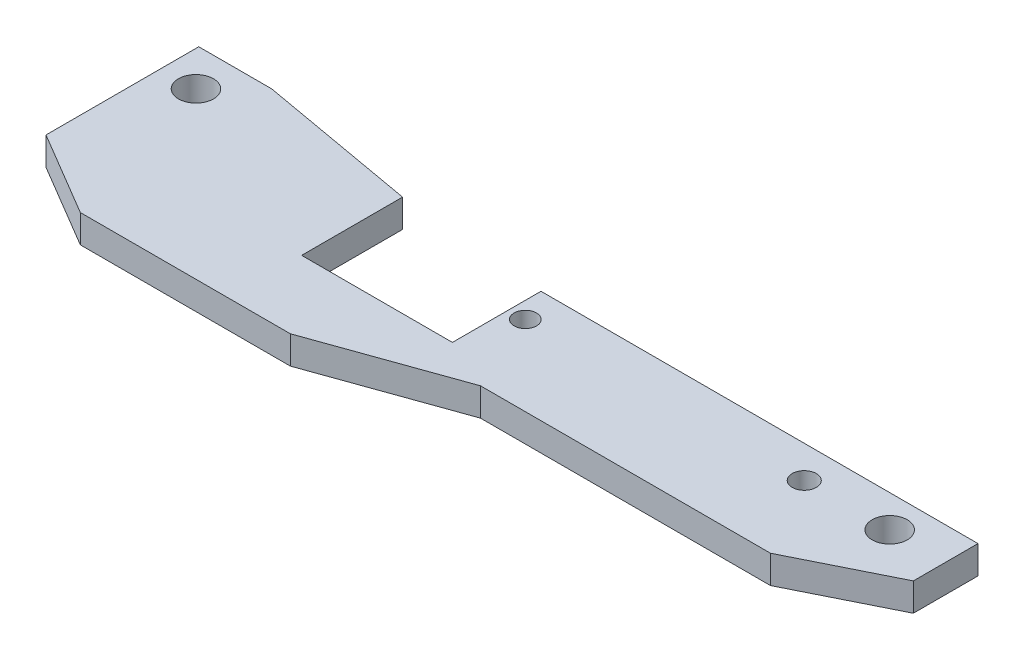
from build123d import *

# Parameters (mm, degrees)
SKETCH1_R           = 1.016
SKETCH1_R_2         = 1.5875
SKETCH1_R_3         = 1.0922
BOSS_EXTRUDE1_DEPTH = 2.54
SKETCH2_W           = 13.662102681
SKETCH2_H           = 9.772536082
CUT_EXTRUDE1_DEPTH  = 2.54


with BuildPart() as part:
    # Sketch1 → Boss-Extrude1 (new body)
    with BuildSketch(Plane(origin=(0, 0, 0), x_dir=(1, 0, 0), z_dir=(0, 1, 0))):
        Polygon((-3.175, 3.429), (-3.175, -10.414), (4.467211682, -14.946323026), (23.497546316, -14.946323026), (36.195, -10.414), (62.473953038, -10.414), (71.12, -6.112857804), (71.12, -0.254), (24.145875, -0.254), (3.429, 3.429), align=None)
        with Locations(Location((33.02, -3.175, 0), (0, 0, 270))):
            Circle(SKETCH1_R, mode=Mode.SUBTRACT)
        with Locations(Location((66.04, -3.175, 0), (0, 0, 270))):
            Circle(SKETCH1_R_2, mode=Mode.SUBTRACT)
        with Locations(Location((0, 0, 0), (0, 0, 270))):
            Circle(SKETCH1_R_2, mode=Mode.SUBTRACT)
        with Locations(Location((58.296606113, -3.175, 0), (0, 0, 270))):
            Circle(SKETCH1_R_3, mode=Mode.SUBTRACT)
    extrude(amount=BOSS_EXTRUDE1_DEPTH)

    # Sketch2 → Cut-Extrude1 (cut)
    with BuildSketch(Plane.XZ):
        with Locations((24.68894866, 3.393977835)):
            Rectangle(SKETCH2_W, SKETCH2_H)
    extrude(amount=-CUT_EXTRUDE1_DEPTH, mode=Mode.SUBTRACT)


solid = part.part
